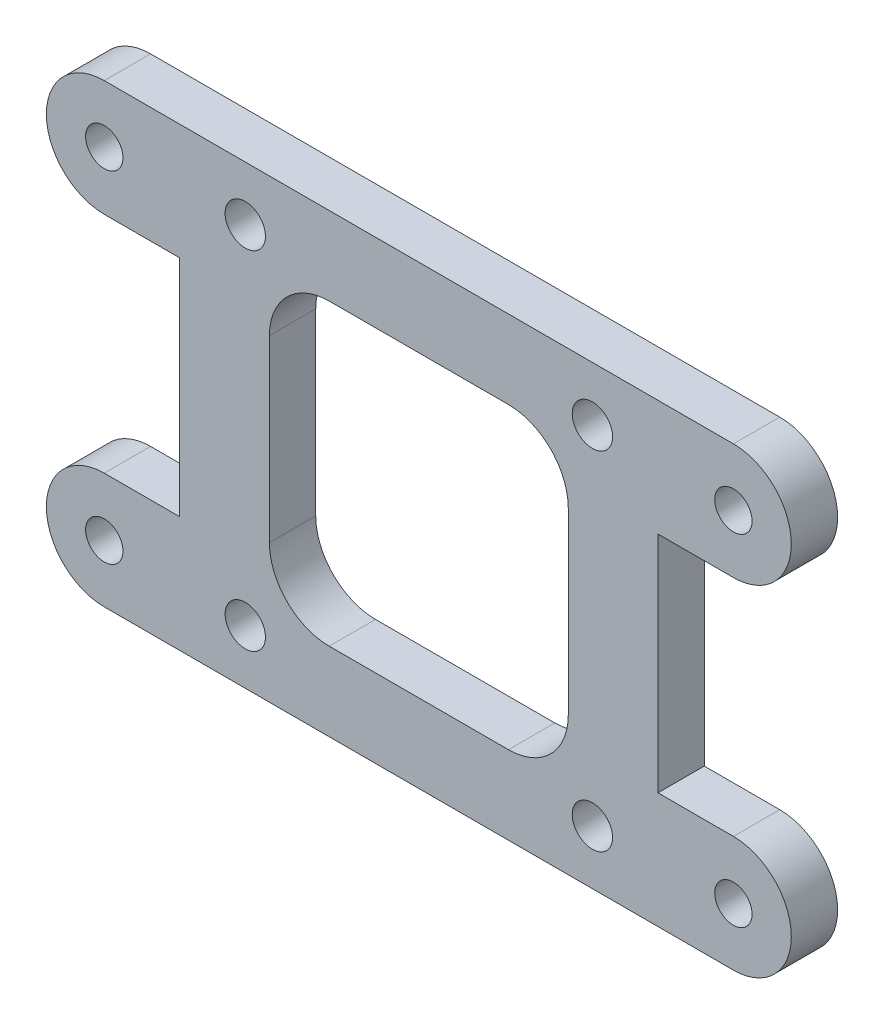
from build123d import *

# Parameters (mm, degrees)
SKETCH1_R      = 1.35
SKETCH1_R_2    = 1.25
EXTRUDE1_DEPTH = 3.1


with BuildPart() as part:
    # Sketch1 → Extrude1 (new body)
    with BuildSketch(Plane.XY):
        with BuildLine():
            Line((-24.241802054, 13.266728144), (-19.191802054, 13.266728144))
            Line((-19.191802054, 13.266728144), (12.808197946, 13.266728144))
            Line((12.808197946, 13.266728144), (17.858197946, 13.266728144))
            ThreePointArc((17.858197946, 13.266728144), (21.733197946, 9.391728144), (17.858197946, 5.516728144))
            Line((17.858197946, 5.516728144), (12.808197946, 5.516728144))
            Line((12.808197946, 5.516728144), (12.808197946, -9.483271856))
            Line((12.808197946, -9.483271856), (17.858197946, -9.483271856))
            ThreePointArc((17.858197946, -9.483271856), (21.733197946, -13.358271856), (17.858197946, -17.233271856))
            Line((17.858197946, -17.233271856), (12.808197946, -17.233271856))
            Line((12.808197946, -17.233271856), (-19.191802054, -17.233271856))
            Line((-19.191802054, -17.233271856), (-24.241802054, -17.233271856))
            ThreePointArc((-24.241802054, -17.233271856), (-28.116802054, -13.358271856), (-24.241802054, -9.483271856))
            Line((-24.241802054, -9.483271856), (-19.191802054, -9.483271856))
            Line((-19.191802054, -9.483271856), (-19.191802054, 5.516728144))
            Line((-19.191802054, 5.516728144), (-24.241802054, 5.516728144))
            ThreePointArc((-24.241802054, 5.516728144), (-28.116802054, 9.391728144), (-24.241802054, 13.266728144))
        make_face()
        with Locations(Location((-14.806030935, 9.630953317, 0), (0, 0, 180))):
            Circle(SKETCH1_R, mode=Mode.SUBTRACT)
        with Locations(Location((8.422426827, -13.597504445, 0), (0, 0, 180))):
            Circle(SKETCH1_R, mode=Mode.SUBTRACT)
        with Locations(Location((-14.806030935, -13.597504445, 0), (0, 0, 180))):
            Circle(SKETCH1_R, mode=Mode.SUBTRACT)
        with Locations(Location((8.422426827, 9.630953317, 0), (0, 0, 180))):
            Circle(SKETCH1_R, mode=Mode.SUBTRACT)
        with Locations(Location((-24.241802054, 9.414269496, 0), (0, 0, 180))):
            Circle(SKETCH1_R_2, mode=Mode.SUBTRACT)
        with Locations(Location((-24.241802054, -13.380813208, 0), (0, 0, 180))):
            Circle(SKETCH1_R_2, mode=Mode.SUBTRACT)
        with Locations(Location((17.858197946, -13.380813208, 0), (0, 0, 180))):
            Circle(SKETCH1_R_2, mode=Mode.SUBTRACT)
        with Locations(Location((17.858197946, 9.414269496, 0), (0, 0, 180))):
            Circle(SKETCH1_R_2, mode=Mode.SUBTRACT)
        with BuildLine():
            Line((-13.191802054, 4.016724436), (-13.191802054, -7.983275564))
            ThreePointArc((-13.191802054, -7.983275564), (-12.020229179, -10.811702689), (-9.191802054, -11.983275564))
            Line((-9.191802054, -11.983275564), (2.808197946, -11.983275564))
            ThreePointArc((2.808197946, -11.983275564), (5.636625071, -10.811702689), (6.808197946, -7.983275564))
            Line((6.808197946, -7.983275564), (6.808197946, 4.016724436))
            ThreePointArc((6.808197946, 4.016724436), (5.636625071, 6.84515156), (2.808197946, 8.016724436))
            Line((2.808197946, 8.016724436), (-9.191802054, 8.016724436))
            ThreePointArc((-9.191802054, 8.016724436), (-12.020229179, 6.84515156), (-13.191802054, 4.016724436))
        make_face(mode=Mode.SUBTRACT)
    extrude(amount=EXTRUDE1_DEPTH)


solid = part.part
